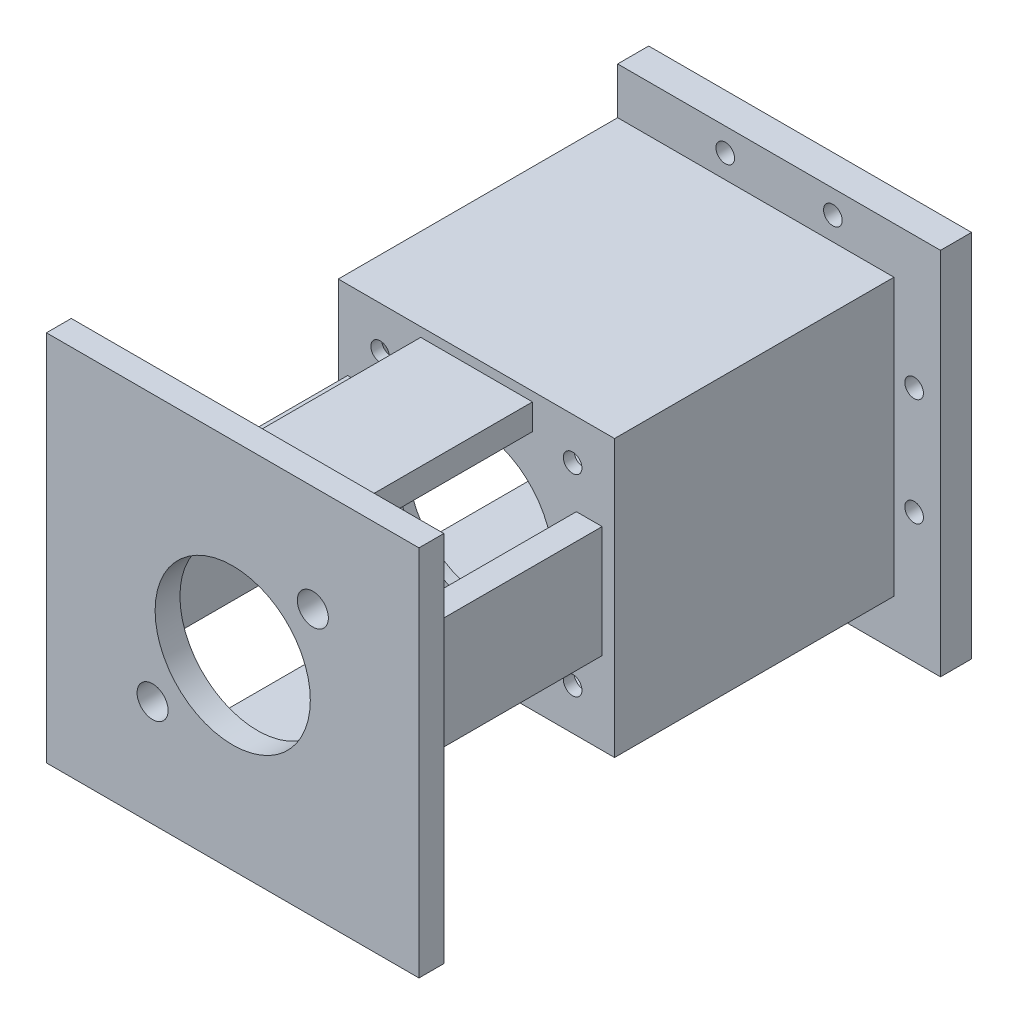
from build123d import *

# Parameters (mm, degrees)
SKETCH6_R           = 1.5
BOSS_EXTRUDE4_DEPTH = 5
SKETCH8_W           = 44.5
SKETCH8_H           = 44.5
SKETCH8_R           = 1.5
SKETCH8_R_2         = 12.5
BOSS_EXTRUDE5_DEPTH = 50
SKETCH7_W           = 43.5
SKETCH7_H           = 42.5
CUT_EXTRUDE4_DEPTH  = 48.25
BOSS_EXTRUDE6_DEPTH = 1
SKETCH11_W          = 18
SKETCH11_H          = 4.15
SKETCH11_W_2        = 4.15
SKETCH11_H_2        = 18
BOSS_EXTRUDE7_DEPTH = 35
SKETCH14_W          = 60
SKETCH14_H          = 60
BOSS_EXTRUDE8_DEPTH = 4
CUT_EXTRUDE5_REACH  = 551.669
SKETCH16_R          = 2.5
SKETCH17_R          = 12.5
CUT_EXTRUDE6_DEPTH  = 550.668785806


with BuildPart() as part:
    # Sketch6 → Boss-Extrude4 (new body)
    with BuildSketch(Plane.XY):
        Polygon((-437.521213625, -225.081134847), (-482.021213625, -225.081134847), (-482.021213625, -232.581134847), (-430.021213625, -232.581134847), (-430.021213625, -173.081134847), (-482.021213625, -173.081134847), (-482.021213625, -180.581134847), (-437.521213625, -180.581134847), align=None)
        with Locations((-464.687880625, -228.331134847)):
            Circle(SKETCH6_R, mode=Mode.SUBTRACT)
        with Locations((-447.354547625, -228.331134847)):
            Circle(SKETCH6_R, mode=Mode.SUBTRACT)
        with Locations((-434.271213625, -211.715651861)):
            Circle(SKETCH6_R, mode=Mode.SUBTRACT)
        with Locations((-464.687883625, -176.831134847)):
            Circle(SKETCH6_R, mode=Mode.SUBTRACT)
        with Locations((-434.271213625, -194.382318861)):
            Circle(SKETCH6_R, mode=Mode.SUBTRACT)
        with Locations((-447.354550625, -176.831134847)):
            Circle(SKETCH6_R, mode=Mode.SUBTRACT)
    extrude(amount=BOSS_EXTRUDE4_DEPTH)

    # Sketch8 → Boss-Extrude5 (add)
    with BuildSketch(Plane.XY):
        with Locations((-459.771213625, -202.831134847)):
            Rectangle(SKETCH8_W, SKETCH8_H)
        with Locations((-475.271213625, -218.331134847)):
            Circle(SKETCH8_R, mode=Mode.SUBTRACT)
        with Locations((-444.271213625, -218.331134847)):
            Circle(SKETCH8_R, mode=Mode.SUBTRACT)
        with Locations((-444.271213625, -187.331134847)):
            Circle(SKETCH8_R, mode=Mode.SUBTRACT)
        with Locations((-475.271213625, -187.331134847)):
            Circle(SKETCH8_R, mode=Mode.SUBTRACT)
        with Locations((-460.021213625, -202.581134847)):
            Circle(SKETCH8_R_2, mode=Mode.SUBTRACT)
    extrude(amount=BOSS_EXTRUDE5_DEPTH)

    # Sketch7 → Cut-Extrude4 (cut)
    with BuildSketch(Plane.XY):
        with Locations((-460.271213625, -202.831134847)):
            Rectangle(SKETCH7_W, SKETCH7_H)
    extrude(amount=CUT_EXTRUDE4_DEPTH, mode=Mode.SUBTRACT)

    # Sketch10 → Boss-Extrude6 (add)
    with BuildSketch(Plane.ZY.offset(482.021213625)):
        Polygon((24.125, -181.581134847), (48.25, -224.081134847), (48.25, -181.581134847), align=None)
    extrude(amount=-BOSS_EXTRUDE6_DEPTH)

    # Sketch11 → Boss-Extrude7 (add)
    with BuildSketch(Plane.XY.offset(50)):
        with Locations((-460.303059696, -221.006134847)):
            Rectangle(SKETCH11_W, SKETCH11_H)
        with Locations((-441.596213625, -202.862980918)):
            Rectangle(SKETCH11_W_2, SKETCH11_H_2)
        with Locations((-478.446213625, -202.299288776)):
            Rectangle(SKETCH11_W_2, SKETCH11_H_2)
        with Locations((-459.739367554, -184.156134847)):
            Rectangle(SKETCH11_W, SKETCH11_H)
    extrude(amount=BOSS_EXTRUDE7_DEPTH)

    # Sketch14 → Boss-Extrude8 (add)
    with BuildSketch(Plane.XY.offset(85)):
        with Locations((-460.021213625, -202.581134847)):
            Rectangle(SKETCH14_W, SKETCH14_H)
    extrude(amount=BOSS_EXTRUDE8_DEPTH)

    # Sketch16 → Cut-Extrude5 (cut, up to next)
    with BuildSketch(Plane.XY.offset(89), mode=Mode.PRIVATE) as cut_extrude5_sk1:
        with Locations((-447.116514868, -189.67643609)):
            Circle(SKETCH16_R)
    cut_extrude5_tool1 = extrude(cut_extrude5_sk1.sketch, amount=-CUT_EXTRUDE5_REACH, mode=Mode.PRIVATE) & part.part
    # Sketch16 → Cut-Extrude5 (cut, up to next)
    with BuildSketch(Plane.XY.offset(89), mode=Mode.PRIVATE) as cut_extrude5_sk2:
        with Locations((-472.925912382, -215.485833604)):
            Circle(SKETCH16_R)
    cut_extrude5_tool2 = extrude(cut_extrude5_sk2.sketch, amount=-CUT_EXTRUDE5_REACH, mode=Mode.PRIVATE) & part.part
    add(cut_extrude5_tool1.solids().sort_by_distance((-447.116515, -189.676436, 89))[0], mode=Mode.SUBTRACT)
    add(cut_extrude5_tool2.solids().sort_by_distance((-472.925912, -215.485834, 89))[0], mode=Mode.SUBTRACT)

    # Sketch17 → Cut-Extrude6 (cut, through all)
    with BuildSketch(Plane.XY):
        with Locations(Location((-460.021213625, -202.581134847, 0), (0, 0, 180))):
            Circle(SKETCH17_R)
    extrude(amount=CUT_EXTRUDE6_DEPTH, mode=Mode.SUBTRACT)


solid = part.part
